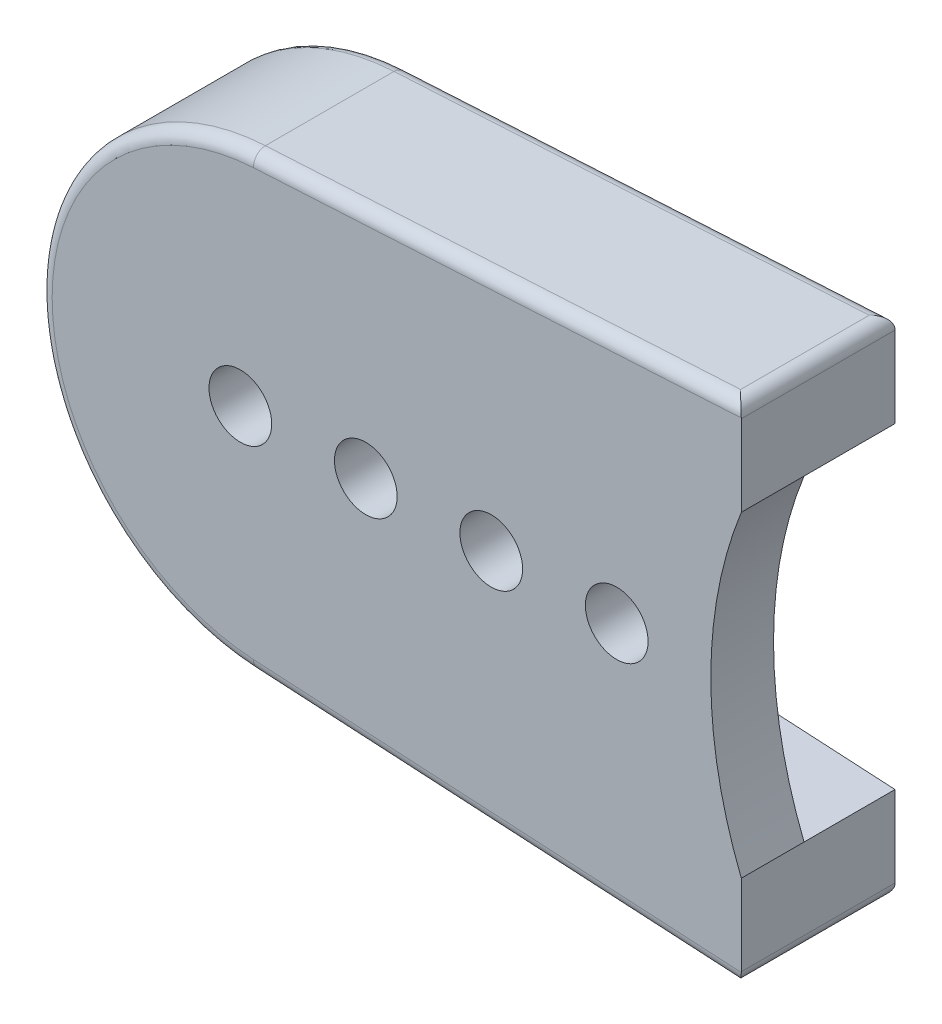
from build123d import *

# Parameters (mm, degrees)
SKETCH_1_R      = 0.5
EXTRUDE_1_DEPTH = 1
EXTRUDE_START   = -2.45
EXTRUDE_2_DEPTH = 2.45
FILLET_1_R      = 0.2


with BuildPart() as part:
    # 草图1 → 凸台-拉伸1 (new body)
    with BuildSketch(Plane.XY):
        with BuildLine():
            Line((-14.016792693, -2.096749739), (-6.313489141, -2.525837459))
            ThreePointArc((-6.313489141, -2.525837459), (-6.8, 0), (-6.313489141, 2.525837459))
            Line((-6.313489141, 2.525837459), (-14.016792693, 2.096749739))
            ThreePointArc((-14.016792693, 2.096749739), (-16, 0), (-14.016792693, -2.096749739))
        make_face()
        with Locations((-10.3, 0)):
            Circle(SKETCH_1_R, mode=Mode.SUBTRACT)
        with Locations((-14.3, 0)):
            Circle(SKETCH_1_R, mode=Mode.SUBTRACT)
        with Locations((-8.3, 0)):
            Circle(SKETCH_1_R, mode=Mode.SUBTRACT)
        with Locations((-12.3, 0)):
            Circle(SKETCH_1_R, mode=Mode.SUBTRACT)
    extrude(amount=EXTRUDE_1_DEPTH)

    # 草图3 → 凸台-拉伸2 (add)
    with BuildSketch(Plane.XY.offset(1).offset(EXTRUDE_START)):
        with BuildLine():
            Line((-6.313489141, 4.028162673), (-14.100216045, 3.594428124))
            ThreePointArc((-14.100216045, 3.594428124), (-17.5, 0), (-14.100216045, -3.594428124))
            Line((-14.100216045, -3.594428124), (-6.313489141, -4.028162673))
            Line((-6.313489141, -4.028162673), (-6.313489141, -2.525837459))
            Line((-6.313489141, -2.525837459), (-14.016792693, -2.096749739))
            ThreePointArc((-14.016792693, -2.096749739), (-16, 0), (-14.016792693, 2.096749739))
            Line((-14.016792693, 2.096749739), (-6.313489141, 2.525837459))
            Line((-6.313489141, 2.525837459), (-6.313489141, 4.028162673))
        make_face()
    extrude(amount=EXTRUDE_2_DEPTH)

    # 圆角1
    fillet_1_edges = [part.edges().sort_by_distance(p)[0] for p in [
        (-10.206852593, 3.811295398, 1),
        (-17.5, 0, 1),
        (-10.206852593, -3.811295398, 1),
        (-17.5, 0, -1.45),
        (-10.206852593, -3.811295398, -1.45),
        (-6.313489141, -4.028162673, -0.225),
        (-6.313489141, 4.028162673, -0.225),
        (-10.206852593, 3.811295398, -1.45),
    ]]
    fillet(fillet_1_edges, radius=FILLET_1_R)


solid = part.part
